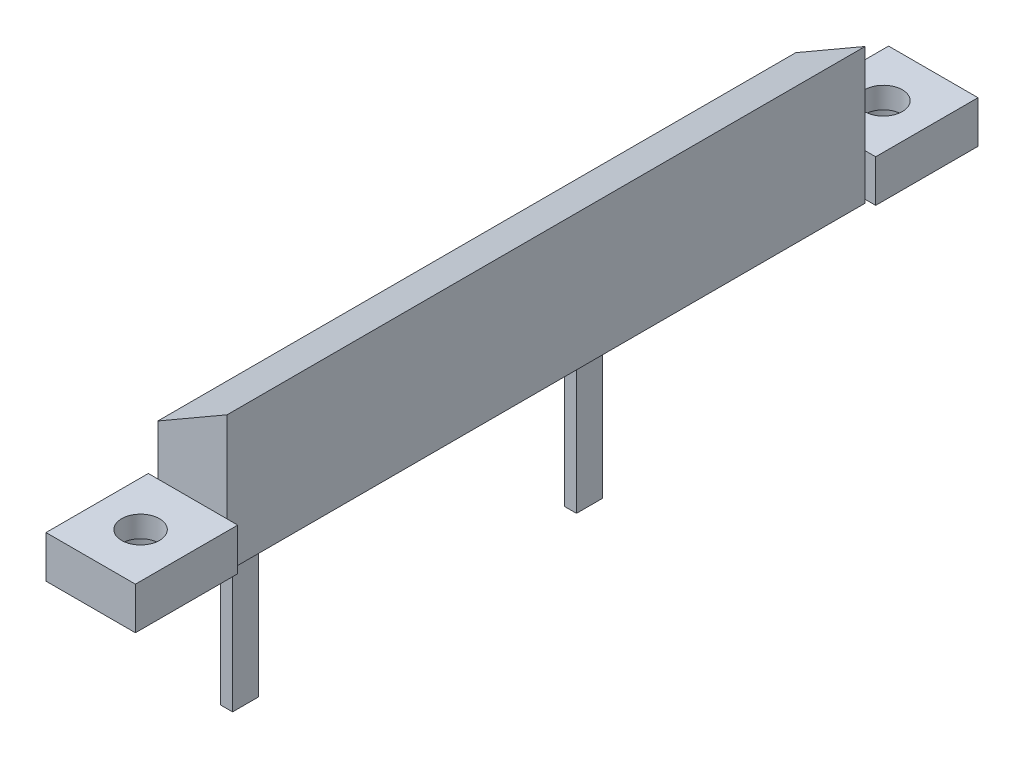
from build123d import *

# Parameters (mm, degrees)
CLAMP_START          = -20.15
CLAMP_X_COVER_DEPTH  = 37.1
EAR_START            = -26.1
SKETCH2_W            = 5.2
SKETCH2_H            = 2.45
EAR_X_COVER_26_DEPTH = 5.95
EAR_START_2          = 16.95
SKETCH3_W            = 5.2
SKETCH3_H            = 2.45
EAR_X_COVER_17_DEPTH = 5.95
CUT_EXTRUDE1_START   = 18.9
SKETCH4_R            = 1.1
CUT_EXTRUDE1_DEPTH   = 2.65
CUT_EXTRUDE2_START   = 18.99
SKETCH5_R            = 2
CUT_EXTRUDE2_DEPTH   = 1.22
BOSS_EXTRUDE4_START  = 7.69
SKETCH6_W            = 0.7
SKETCH6_H            = 1.5
BOSS_EXTRUDE4_DEPTH  = 11.11
BOSS_EXTRUDE5_START  = 7.69
SKETCH7_W            = 0.7
SKETCH7_H            = 1.5
BOSS_EXTRUDE5_DEPTH  = 11.11


with BuildPart() as part:
    # Sketch1 → Clamp -X cover (new body)
    with BuildSketch(Plane.XY.offset(CLAMP_START)):
        Polygon((-17.397275866, 18.8), (-13.367148847, 18.8), (-13.367148847, 26.696897507), (-17.397275866, 24.370102587), align=None)
    extrude(amount=CLAMP_X_COVER_DEPTH)

    # Sketch2 → Ear -X cover -26 (add)
    with BuildSketch(Plane.XY.offset(EAR_START)):
        with Locations((-15.35, 20.225)):
            Rectangle(SKETCH2_W, SKETCH2_H)
    extrude(amount=EAR_X_COVER_26_DEPTH)

    # Sketch3 → Ear -X cover 17 (add)
    with BuildSketch(Plane.XY.offset(EAR_START_2)):
        with Locations((-15.35, 20.225)):
            Rectangle(SKETCH3_W, SKETCH3_H)
    extrude(amount=EAR_X_COVER_17_DEPTH)

    # Sketch4 → Cut-Extrude1 (cut)
    with BuildSketch(Plane(origin=(0, 0, 0), x_dir=(1, 0, 0), z_dir=(0, 1, 0)).offset(CUT_EXTRUDE1_START)):
        with Locations(Location((-15.35, 23.2, 0), (0, 0, 90))):
            Circle(SKETCH4_R)
        with Locations(Location((-15.35, -20, 0), (0, 0, 90))):
            Circle(SKETCH4_R)
    extrude(amount=CUT_EXTRUDE1_DEPTH, mode=Mode.SUBTRACT)

    # Sketch5 → Cut-Extrude2 (cut)
    with BuildSketch(Plane(origin=(0, 0, 0), x_dir=(1, 0, 0), z_dir=(0, 1, 0)).offset(CUT_EXTRUDE2_START)):
        with Locations(Location((-15.35, 23.2, 0), (0, 0, 270))):
            Circle(SKETCH5_R)
        with Locations(Location((-15.35, -20, 0), (0, 0, 270))):
            Circle(SKETCH5_R)
    extrude(amount=CUT_EXTRUDE2_DEPTH, mode=Mode.SUBTRACT)

    # Sketch6 → Boss-Extrude4 (add)
    with BuildSketch(Plane(origin=(0, 0, 0), x_dir=(1, 0, 0), z_dir=(0, 1, 0)).offset(BOSS_EXTRUDE4_START)):
        with Locations((-17.6, 8)):
            Rectangle(SKETCH6_W, SKETCH6_H)
    extrude(amount=BOSS_EXTRUDE4_DEPTH)

    # Sketch7 → Boss-Extrude5 (add)
    with BuildSketch(Plane(origin=(0, 0, 0), x_dir=(1, 0, 0), z_dir=(0, 1, 0)).offset(BOSS_EXTRUDE5_START)):
        with Locations((-17.6, -12)):
            Rectangle(SKETCH7_W, SKETCH7_H)
    extrude(amount=BOSS_EXTRUDE5_DEPTH)


solid = part.part
